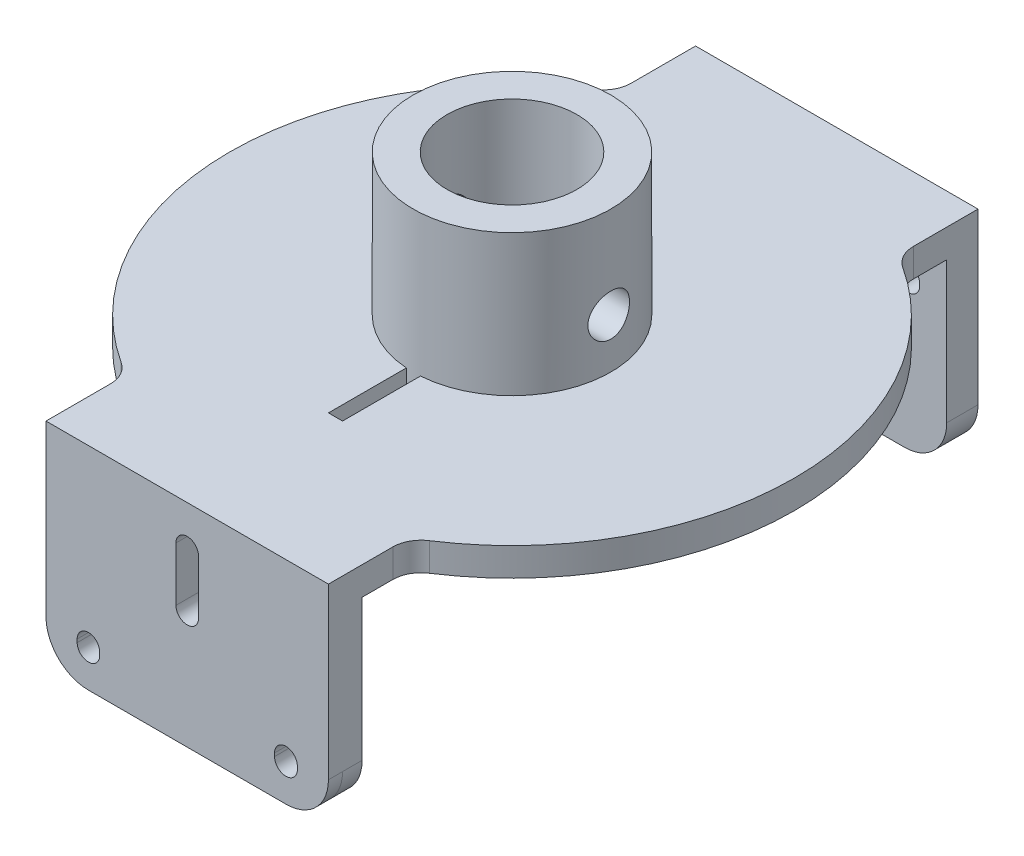
from build123d import *

# Parameters (mm, degrees)
SKETCH_1_W               = 20
SKETCH_1_H               = 13
SKETCH_1_R               = 0.8
EXTRUDE_1_DEPTH          = 2
EXTRUDE_2_DEPTH          = 2
SKETCH_3_R               = 7
SKETCH_3_R_2             = 4.6
EXTRUDE_3_DEPTH          = 10
SKETCH_4_R               = 20
EXTRUDE_4_DEPTH          = 2
SKETCH_6_W               = 20.177677641
SKETCH_6_H               = 1.475
FILLET_1_R               = 3
CUT_EXTRUDE_1_REACH      = 49.896
CUT_EXTRUDE_1_END_RADIUS = 7
EXTRUDE_5_DEPTH          = 2
SKETCH_9_R               = 0.8
EXTRUDE_6_DEPTH          = 2
CUT_EXTRUDE_2_REACH      = 58.436
SKETCH_10_W              = 20
SKETCH_10_H              = 0.613752116
SKETCH_10_H_2            = 0.786247884
FILLET_2_R               = 3
CUT_EXTRUDE_START        = -10
CUT_EXTRUDE_3_DEPTH      = 10
CUT_EXTRUDE_4_DEPTH      = 10
FILLET_3_R               = 2
SKETCH_13_W              = 20
SKETCH_13_H              = 15
EXTRUDE_7_DEPTH          = 3.213752116
FILLET_4_R               = 3
CUT_EXTRUDE_5_DEPTH      = 3.213752116
CUT_EXTRUDE_6_DEPTH      = 1
CUT_EXTRUDE_7_REACH      = 58.93
SKETCH_16_W              = 20
SKETCH_16_H              = 1


with BuildPart() as part:
    # 草图1 → 凸台-拉伸1 (new body)
    with BuildSketch(Plane.XY):
        with Locations((10, -6.5)):
            Rectangle(SKETCH_1_W, SKETCH_1_H)
        with Locations((10, -2.8)):
            Circle(SKETCH_1_R, mode=Mode.SUBTRACT)
        with Locations((17, -9.8)):
            Circle(SKETCH_1_R, mode=Mode.SUBTRACT)
        with Locations(Location((3, -9.8, 0), (0, 0, 180))):
            Circle(SKETCH_1_R, mode=Mode.SUBTRACT)
    extrude_1 = extrude(amount=EXTRUDE_1_DEPTH)

    # 草图2 → 凸台-拉伸2 (add)
    with BuildSketch(Plane(origin=(0, 0, 0), x_dir=(1, 0, 0), z_dir=(0, 1, 0))):
        Polygon((0, 0), (0, -44), (0, -44.5), (20, -44.5), (20, -44), (20, 0), (20, 0.5), (0, 0.5), align=None)
    extrude(amount=EXTRUDE_2_DEPTH)

    # 镜向1: 凸台-拉伸1 across plane
    add(extrude_1.mirror(Plane.XY.offset(22)))

    # 草图3 → 凸台-拉伸3 (add)
    with BuildSketch(Plane(origin=(0, 2, 0), x_dir=(1, 0, 0), z_dir=(0, 1, 0))):
        with Locations((10, -22)):
            Circle(SKETCH_3_R)
        with Locations(Location((10, -22, 0), (0, 0, 180))):
            Circle(SKETCH_3_R_2, mode=Mode.SUBTRACT)
    extrude(amount=EXTRUDE_3_DEPTH)

    # 草图4 → 凸台-拉伸4 (add)
    with BuildSketch(Plane(origin=(0, 2, 0), x_dir=(1, 0, 0), z_dir=(0, 1, 0))):
        with Locations((10, -22)):
            Circle(SKETCH_4_R)
    extrude(amount=-EXTRUDE_4_DEPTH)

    # 草图6 → 切除-旋转1 (revolve, cut)
    with BuildSketch(Plane(origin=(0, 5.5, 0), x_dir=(1, 0, 0), z_dir=(0, 1, 0)), mode=Mode.PRIVATE) as cut_revolve_1_sk:
        with Locations((10.210002175, -21.25904805)):
            Rectangle(SKETCH_6_W, SKETCH_6_H)
    revolve(cut_revolve_1_sk.sketch.rotate(Axis((22.976612399, 5.5, 21.99654805), (-1, 0, 0)), 270), axis=Axis((22.976612399, 5.5, 21.99654805), (-1, 0, 0)), mode=Mode.SUBTRACT)

    # 圆角1
    fillet_1_edges = [part.edges().sort_by_distance(p)[0] for p in [
        (0, -13, 43),
        (20, -13, 43),
        (20, -13, 1),
        (0, -13, 1),
    ]]
    fillet(fillet_1_edges, radius=FILLET_1_R)

    # 切除-拉伸1: up to this cylinder (the profile starts outside it)
    cut_extrude_1_end = Plane(origin=(10, 1.219379, 22), z_dir=(0, -1, 0)) * Cylinder(CUT_EXTRUDE_1_END_RADIUS, 114.792, mode=Mode.PRIVATE)
    # 草图7 → 切除-拉伸1 (cut, up to the surface)
    with BuildSketch(Plane.XY.offset(34.5), mode=Mode.PRIVATE) as cut_extrude_1_sk1:
        Polygon((10, -0.174604114), (10.5, -0.174604114), (10.5, 2.613362212), (9.5, 2.613362212), (9.5, -0.174604114), align=None)
    cut_extrude_1_tool1 = extrude(cut_extrude_1_sk1.sketch, amount=-CUT_EXTRUDE_1_REACH, mode=Mode.PRIVATE) - cut_extrude_1_end
    add(cut_extrude_1_tool1.solids().sort_by_distance((10, 1.219379, 34.5))[0], mode=Mode.SUBTRACT)

    # 草图8 → 凸台-拉伸5 (add)
    with BuildSketch(Plane(origin=(0, 0, 0), x_dir=(-1, 0, 0), z_dir=(0, 0, -1))):
        Polygon((0, 0), (0, -13), (-20, -13), (-20, 0), (-20, 2), (0, 2), align=None)
        with BuildLine():
            Line((-18.05, -11.419506456), (-18.05, -9.69245789))
            ThreePointArc((-18.05, -9.69245789), (-17.25, -8.89245789), (-16.45, -9.69245789))
            Line((-16.45, -9.69245789), (-16.45, -11.419506456))
            ThreePointArc((-16.45, -11.419506456), (-17.25, -12.219506456), (-18.05, -11.419506456))
        make_face(mode=Mode.SUBTRACT)
        with BuildLine():
            Line((-1.95, -11.419506456), (-1.95, -9.69245789))
            ThreePointArc((-1.95, -9.69245789), (-2.75, -8.89245789), (-3.55, -9.69245789))
            Line((-3.55, -9.69245789), (-3.55, -11.419506456))
            ThreePointArc((-3.55, -11.419506456), (-2.75, -12.219506456), (-1.95, -11.419506456))
        make_face(mode=Mode.SUBTRACT)
    extrude(amount=EXTRUDE_5_DEPTH)

    # 草图9 → 凸台-拉伸6 (add)
    with BuildSketch(Plane.XY.offset(44)):
        Polygon((20, 0), (20, -13), (0, -13), (0, 0), (0, 2), (20, 2), align=None)
        with Locations((10, -2.8)):
            Circle(SKETCH_9_R, mode=Mode.SUBTRACT)
    extrude(amount=EXTRUDE_6_DEPTH)

    # 切除-拉伸2: up to this face of the body (flat: up to its plane)
    cut_extrude_2_end = Plane(part.part.faces().sort_by_distance((10, -13, -0.176470588))[0])
    # 草图10 → 切除-拉伸2 (cut, up to the picked face)
    with BuildSketch(Plane.XZ, mode=Mode.PRIVATE) as cut_extrude_2_sk1:
        Polygon((20, 42), (0, 42), (0, 39.320508076), (0, 4.679491924), (0, 2), (20, 2), (20, 4.679491924), (20, 39.320508076), align=None)
        with BuildLine():
            Line((9.5, 28.982120022), (9.5, 34.5))
            Line((9.5, 34.5), (10.5, 34.5))
            Line((10.5, 34.5), (10.5, 28.982120022))
            ThreePointArc((10.5, 28.982120022), (10, 29), (9.5, 28.982120022))
        make_face(mode=Mode.SUBTRACT)
    cut_extrude_2_tool1 = split(extrude(cut_extrude_2_sk1.sketch, amount=CUT_EXTRUDE_2_REACH, mode=Mode.PRIVATE), bisect_by=cut_extrude_2_end, keep=Keep.BOTH, mode=Mode.PRIVATE)
    # 草图10 → 切除-拉伸2 (cut, up to the picked face)
    with BuildSketch(Plane.XZ, mode=Mode.PRIVATE) as cut_extrude_2_sk2:
        with Locations((10, 42.306876058)):
            Rectangle(SKETCH_10_W, SKETCH_10_H)
    cut_extrude_2_tool2 = split(extrude(cut_extrude_2_sk2.sketch, amount=CUT_EXTRUDE_2_REACH, mode=Mode.PRIVATE), bisect_by=cut_extrude_2_end, keep=Keep.BOTH, mode=Mode.PRIVATE)
    # 草图10 → 切除-拉伸2 (cut, up to the picked face)
    with BuildSketch(Plane.XZ, mode=Mode.PRIVATE) as cut_extrude_2_sk3:
        with Locations((10, 1.606876058)):
            Rectangle(SKETCH_10_W, SKETCH_10_H_2)
    cut_extrude_2_tool3 = split(extrude(cut_extrude_2_sk3.sketch, amount=CUT_EXTRUDE_2_REACH, mode=Mode.PRIVATE), bisect_by=cut_extrude_2_end, keep=Keep.BOTH, mode=Mode.PRIVATE)
    add(cut_extrude_2_tool1.solids().sort_by(Axis((10, 0, 21.932452), (0, -1, 0)))[0], mode=Mode.SUBTRACT)
    add(cut_extrude_2_tool2.solids().sort_by(Axis((10, 0, 42.306876), (0, -1, 0)))[0], mode=Mode.SUBTRACT)
    add(cut_extrude_2_tool3.solids().sort_by(Axis((10, 0, 1.606876), (0, -1, 0)))[0], mode=Mode.SUBTRACT)

    # 圆角2
    fillet_2_edges = [part.edges().sort_by_distance(p)[0] for p in [
        (0, -13, -1),
        (20, -13, -1),
        (0, -13, 45),
        (20, -13, 45),
    ]]
    fillet(fillet_2_edges, radius=FILLET_2_R)

    # 草图11 → 切除-拉伸3 (cut)
    with BuildSketch(Plane(origin=(0, 0, -2), x_dir=(-1, 0, 0), z_dir=(0, 0, -1)).offset(CUT_EXTRUDE_START)):
        with BuildLine():
            ThreePointArc((-16.45, -11.419506456), (-17.25, -12.219506456), (-18.05, -11.419506456))
            Line((-18.05, -11.419506456), (-18.05, -9.69245789))
            ThreePointArc((-18.05, -9.69245789), (-17.25, -8.89245789), (-16.45, -9.69245789))
            Line((-16.45, -9.69245789), (-16.45, -11.419506456))
        make_face()
        with BuildLine():
            ThreePointArc((-1.95, -11.419506456), (-2.75, -12.219506456), (-3.55, -11.419506456))
            Line((-3.55, -11.419506456), (-3.55, -9.69245789))
            ThreePointArc((-3.55, -9.69245789), (-2.75, -8.89245789), (-1.95, -9.69245789))
            Line((-1.95, -9.69245789), (-1.95, -11.419506456))
        make_face()
    extrude(amount=CUT_EXTRUDE_3_DEPTH, mode=Mode.SUBTRACT)

    # 草图12 → 切除-拉伸4 (cut)
    with BuildSketch(Plane.XY.offset(46)):
        with BuildLine():
            Line((10.8, -0.877995813), (10.8, -4.703761183))
            ThreePointArc((10.8, -4.703761183), (10, -5.503761183), (9.2, -4.703761183))
            Line((9.2, -4.703761183), (9.2, -0.877995813))
            ThreePointArc((9.2, -0.877995813), (10, -0.077995813), (10.8, -0.877995813))
        make_face()
        with BuildLine():
            Line((3.8, -10.260625083), (3.8, -10.483938274))
            ThreePointArc((3.8, -10.483938274), (3.004149842, -11.279788432), (2.208299685, -10.483938274))
            Line((2.208299685, -10.483938274), (2.208299685, -10.260625083))
            ThreePointArc((2.208299685, -10.260625083), (3.004149842, -9.464774926), (3.8, -10.260625083))
        make_face()
        with BuildLine():
            Line((17.8, -10.260625083), (17.8, -10.483938274))
            ThreePointArc((17.8, -10.483938274), (16.992509178, -11.291429096), (16.185018357, -10.483938274))
            Line((16.185018357, -10.483938274), (16.185018357, -10.260625083))
            ThreePointArc((16.185018357, -10.260625083), (16.992509178, -9.453134262), (17.8, -10.260625083))
        make_face()
    extrude(amount=-CUT_EXTRUDE_4_DEPTH, mode=Mode.SUBTRACT)

    # 圆角3
    fillet_3_edges = [part.edges().sort_by_distance(p)[0] for p in [
        (0, 1, 4.679491924),
        (20, 1, 4.679491924),
        (0, 1, 39.320508076),
        (20, 1, 39.320508076),
    ]]
    fillet(fillet_3_edges, radius=FILLET_3_R)

    # 草图13 → 凸台-拉伸7 (add)
    with BuildSketch(Plane(origin=(0, 0, -2), x_dir=(-1, 0, 0), z_dir=(0, 0, -1))):
        with Locations((-10, -5.5)):
            Rectangle(SKETCH_13_W, SKETCH_13_H)
        with BuildLine():
            Line((-18.05, -2.863524283), (-18.05, -1.136475717))
            ThreePointArc((-18.05, -1.136475717), (-17.25, -0.336475717), (-16.45, -1.136475717))
            Line((-16.45, -1.136475717), (-16.45, -2.863524283))
            ThreePointArc((-16.45, -2.863524283), (-17.25, -3.663524283), (-18.05, -2.863524283))
        make_face(mode=Mode.SUBTRACT)
        with BuildLine():
            Line((-1.95, -2.863524283), (-1.95, -1.136475717))
            ThreePointArc((-1.95, -1.136475717), (-2.75, -0.336475717), (-3.55, -1.136475717))
            Line((-3.55, -1.136475717), (-3.55, -2.863524283))
            ThreePointArc((-3.55, -2.863524283), (-2.75, -3.663524283), (-1.95, -2.863524283))
        make_face(mode=Mode.SUBTRACT)
    extrude(amount=-EXTRUDE_7_DEPTH)

    # 圆角4
    fillet_4_edges = [part.edges().sort_by_distance(p)[0] for p in [
        (0, -13, -0.393123942),
        (20, -13, -0.393123942),
    ]]
    fillet(fillet_4_edges, radius=FILLET_4_R)

    # 草图14 → 切除-拉伸5 (cut)
    with BuildSketch(Plane(origin=(0, 0, -2), x_dir=(-1, 0, 0), z_dir=(0, 0, -1))):
        with BuildLine():
            Line((-18.083873796, -2.573949701), (-18.083873796, -2.42101558))
            ThreePointArc((-18.083873796, -2.42101558), (-17.283873796, -1.62101558), (-16.483873796, -2.42101558))
            Line((-16.483873796, -2.42101558), (-16.483873796, -2.573949701))
            ThreePointArc((-16.483873796, -2.573949701), (-17.283873796, -3.373949701), (-18.083873796, -2.573949701))
        make_face()
        with BuildLine():
            Line((-1.916126204, -2.573949701), (-1.916126204, -2.42101558))
            ThreePointArc((-1.916126204, -2.42101558), (-2.716126204, -1.62101558), (-3.516126204, -2.42101558))
            Line((-3.516126204, -2.42101558), (-3.516126204, -2.573949701))
            ThreePointArc((-3.516126204, -2.573949701), (-2.716126204, -3.373949701), (-1.916126204, -2.573949701))
        make_face()
    extrude(amount=-CUT_EXTRUDE_5_DEPTH, mode=Mode.SUBTRACT)

    # 草图15 → 切除-拉伸6 (cut)
    with BuildSketch(Plane.XZ):
        Polygon((10.5, 32.241060011), (10.5, 31.741060011), (10.5, 31.241060011), (14.5, 31.241060011), (14.5, 32.241060011), align=None)
    extrude(amount=-CUT_EXTRUDE_6_DEPTH, mode=Mode.SUBTRACT)

    # 切除-拉伸7: up to this face of the body (flat: up to its plane)
    cut_extrude_7_end = Plane(part.part.faces().sort_by_distance((10, -13, -0.393123942))[0])
    # 草图16 → 切除-拉伸7 (cut, up to the picked face)
    with BuildSketch(Plane(origin=(0, 2, 0), x_dir=(1, 0, 0), z_dir=(0, 1, 0)), mode=Mode.PRIVATE) as cut_extrude_7_sk1:
        with Locations((10, 1.5)):
            Rectangle(SKETCH_16_W, SKETCH_16_H)
    cut_extrude_7_tool1 = split(extrude(cut_extrude_7_sk1.sketch, amount=-CUT_EXTRUDE_7_REACH, mode=Mode.PRIVATE), bisect_by=cut_extrude_7_end, keep=Keep.BOTH, mode=Mode.PRIVATE)
    # 草图16 → 切除-拉伸7 (cut, up to the picked face)
    with BuildSketch(Plane(origin=(0, 2, 0), x_dir=(1, 0, 0), z_dir=(0, 1, 0)), mode=Mode.PRIVATE) as cut_extrude_7_sk2:
        with Locations((10, -45.5)):
            Rectangle(SKETCH_16_W, SKETCH_16_H)
    cut_extrude_7_tool2 = split(extrude(cut_extrude_7_sk2.sketch, amount=-CUT_EXTRUDE_7_REACH, mode=Mode.PRIVATE), bisect_by=cut_extrude_7_end, keep=Keep.BOTH, mode=Mode.PRIVATE)
    add(cut_extrude_7_tool1.solids().sort_by(Axis((10, 2, -1.5), (0, -1, 0)))[0], mode=Mode.SUBTRACT)
    add(cut_extrude_7_tool2.solids().sort_by(Axis((10, 2, 45.5), (0, -1, 0)))[0], mode=Mode.SUBTRACT)


solid = part.part
